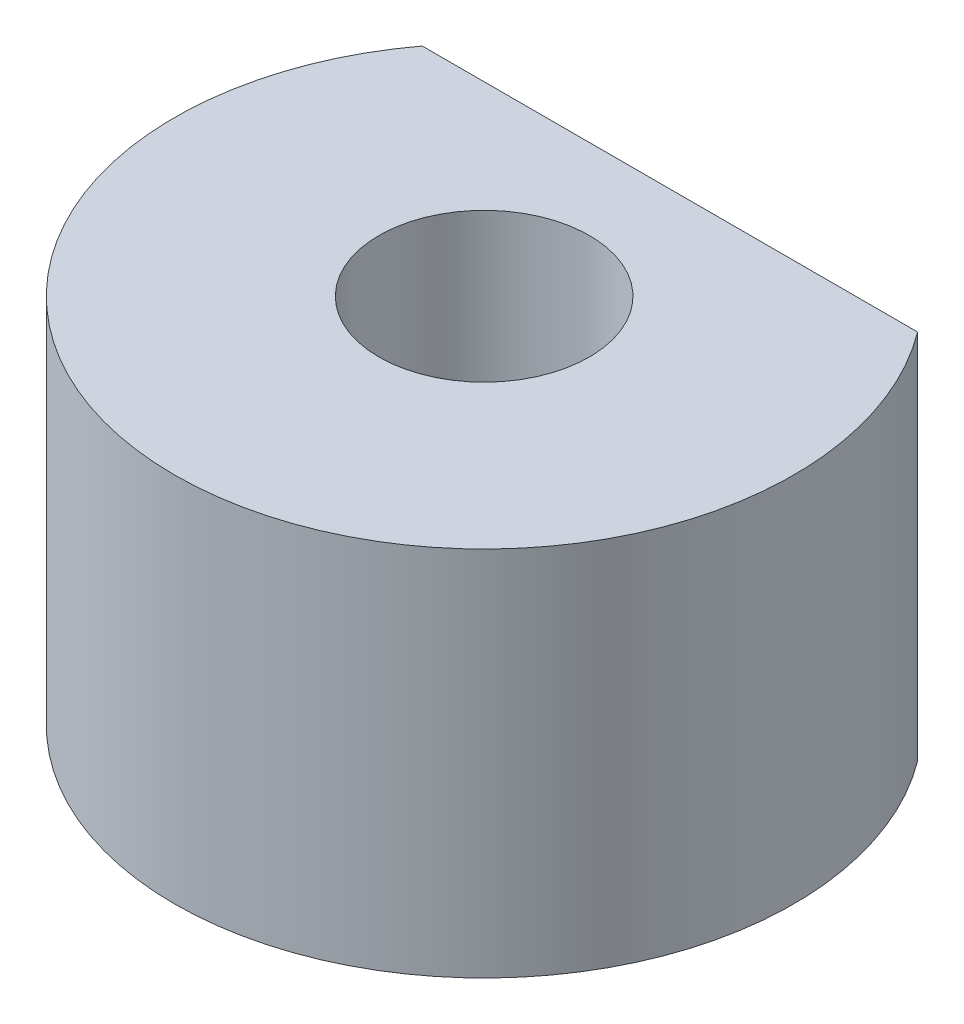
from build123d import *

# Parameters (mm, degrees)
SKETCH1_R           = 1.7
BOSS_EXTRUDE1_DEPTH = 6


with BuildPart() as part:
    # Sketch1 → Boss-Extrude1 (new body)
    with BuildSketch(Plane(origin=(0, 0, 0), x_dir=(1, 0, 0), z_dir=(0, 1, 0))):
        with BuildLine():
            Line((-4, 3), (4, 3))
            ThreePointArc((4, 3), (0, -5), (-4, 3))
        make_face()
        with Locations(Location((0, 0, 0), (0, 0, 270))):
            Circle(SKETCH1_R, mode=Mode.SUBTRACT)
    extrude(amount=BOSS_EXTRUDE1_DEPTH)


solid = part.part
